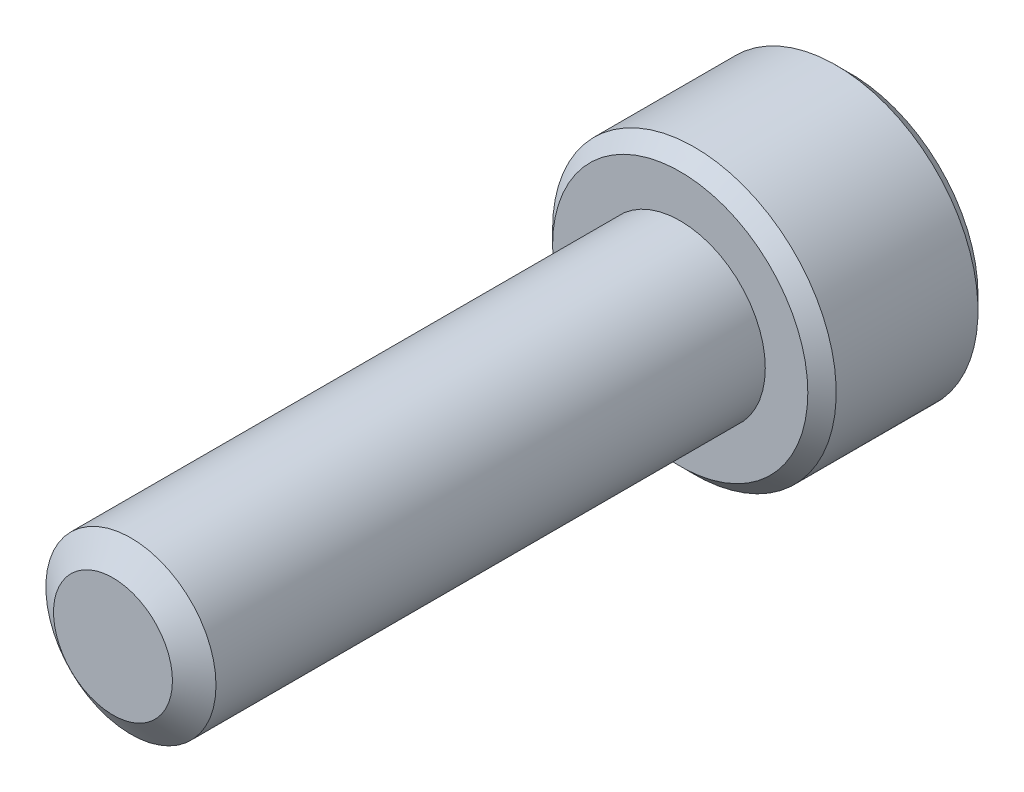
from build123d import *

# Parameters (mm, degrees)
SKETCH1_R          = 3
EXTRUDE1_DEPTH     = 20
SKETCH6_R          = 5
EXTRUDE2_DEPTH     = 6
CUT_EXTRUDE1_DEPTH = 3.75
CHAMFER1_SIZE      = 0.5


with BuildPart() as part:
    # Sketch1 → Extrude1 (new body)
    with BuildSketch(Plane.XY):
        Circle(SKETCH1_R)
    extrude(amount=-EXTRUDE1_DEPTH)

    # Sketch4 → Cut-Revolve1 (revolve, cut)
    with BuildSketch(Plane(origin=(0, 0, 0), x_dir=(0, 0, -1), z_dir=(1, 0, 0))):
        Polygon((0.632650852, 3), (0, 2.096480947), (0, 3), align=None)
    revolve(axis=Axis((0, 0, 0), (0, 0, -1)), mode=Mode.SUBTRACT)

    # Sketch6 → Extrude2 (add)
    with BuildSketch(Plane(origin=(0, 0, -20), x_dir=(-1, 0, 0), z_dir=(0, 0, -1))):
        Circle(SKETCH6_R)
    extrude(amount=EXTRUDE2_DEPTH)

    # Sketch7 → Cut-Extrude1 (cut)
    with BuildSketch(Plane(origin=(0, 0, -26), x_dir=(-1, 0, 0), z_dir=(0, 0, -1))):
        Polygon((0, 2.886751346), (-2.5, 1.443375673), (-2.5, -1.443375673), (0, -2.886751346), (2.5, -1.443375673), (2.5, 1.443375673), align=None)
    extrude(amount=-CUT_EXTRUDE1_DEPTH, mode=Mode.SUBTRACT)

    # Chamfer1
    chamfer1_edges = [part.edges().sort_by_distance(p)[0] for p in [
        (5, 0, -26),
        (5, 0, -20),
    ]]
    chamfer(chamfer1_edges, length=CHAMFER1_SIZE)


solid = part.part
